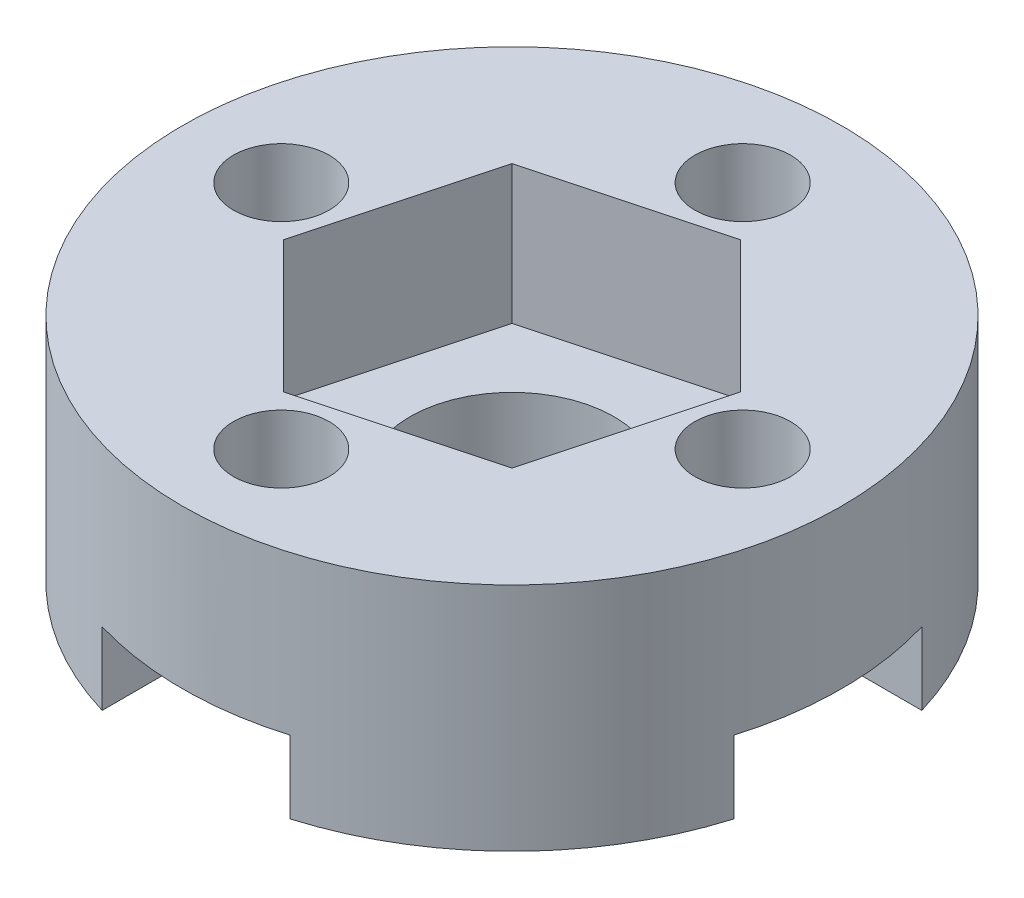
from build123d import *
from build123d.topology import SkipClean

# Parameters (mm, degrees)
SKETCH1_R           = 10
SKETCH1_R_2         = 3.1
SKETCH1_R_3         = 1.45
BOSS_EXTRUDE1_DEPTH = 7
BOSS_EXTRUDE4_START = 1
SKETCH8_R           = 5.25
SKETCH8_R_2         = 3.1
BOSS_EXTRUDE4_DEPTH = 1
CUT_EXTRUDE1_DEPTH  = 3.2
CUT_EXTRUDE2_DEPTH  = 4.2


with BuildPart() as part:
    # Sketch1 → Boss-Extrude1 (new body)
    with BuildSketch(Plane(origin=(0, 0, 0), x_dir=(1, 0, 0), z_dir=(0, 1, 0))):
        with Locations(Location((0, 0, 0), (0, 0, 270))):
            Circle(SKETCH1_R)
        with Locations(Location((0, 0, 0), (0, 0, 270))):
            Circle(SKETCH1_R_2, mode=Mode.SUBTRACT)
        with Locations(Location((0, 7, 0), (0, 0, 270))):
            Circle(SKETCH1_R_3, mode=Mode.SUBTRACT)
        with Locations(Location((7, 0, 0), (0, 0, 270))):
            Circle(SKETCH1_R_3, mode=Mode.SUBTRACT)
        with Locations(Location((0, -7, 0), (0, 0, 270))):
            Circle(SKETCH1_R_3, mode=Mode.SUBTRACT)
        with Locations(Location((-7, 0, 0), (0, 0, 270))):
            Circle(SKETCH1_R_3, mode=Mode.SUBTRACT)
    extrude(amount=BOSS_EXTRUDE1_DEPTH)

    # Sketch8 → Boss-Extrude4 (add)
    with SkipClean():  # the faces are left unmerged after this step: merging them gives an invalid solid
        with BuildSketch(Plane.XZ.offset(BOSS_EXTRUDE4_START)):
            with Locations(Location((0, 0, 0), (0, 0, 90))):
                Circle(SKETCH8_R)
            with Locations(Location((0, 0, 0), (0, 0, 270))):
                Circle(SKETCH8_R_2, mode=Mode.SUBTRACT)
        extrude(amount=-BOSS_EXTRUDE4_DEPTH)

    # Sketch9 → Cut-Extrude1 (cut)
    with SkipClean():  # the faces are left unmerged after this step: merging them gives an invalid solid
        with BuildSketch(Plane.XZ.offset(1)):
            with BuildLine():
                Line((-7, 2.85), (-9.585275166, 2.85))
                ThreePointArc((-9.585275166, 2.85), (-10, 0), (-9.585275166, -2.85))
                Line((-9.585275166, -2.85), (-7, -2.85))
                ThreePointArc((-7, -2.85), (-5.845254282, -2.605582915), (-4.888571429, -1.914254264))
                ThreePointArc((-4.888571429, -1.914254264), (-5.25, 0), (-4.888571429, 1.914254264))
                ThreePointArc((-4.888571429, 1.914254264), (-5.845254282, 2.605582915), (-7, 2.85))
            make_face()
            with BuildLine():
                Line((-2.85, 9.585275166), (-2.85, 7))
                ThreePointArc((-2.85, 7), (-2.605582915, 5.845254282), (-1.914254264, 4.888571429))
                ThreePointArc((-1.914254264, 4.888571429), (0, 5.25), (1.914254264, 4.888571429))
                ThreePointArc((1.914254264, 4.888571429), (2.605582915, 5.845254282), (2.85, 7))
                Line((2.85, 7), (2.85, 9.585275166))
                ThreePointArc((2.85, 9.585275166), (0, 10), (-2.85, 9.585275166))
            make_face()
            with BuildLine():
                ThreePointArc((10, 0), (9.895775656, 1.440008393), (9.585275166, 2.85))
                Line((9.585275166, 2.85), (7, 2.85))
                ThreePointArc((7, 2.85), (5.845254282, 2.605582915), (4.888571429, 1.914254264))
                ThreePointArc((4.888571429, 1.914254264), (5.158851616, 0.974037987), (5.25, 0))
                ThreePointArc((5.25, 0), (5.158851616, -0.974037987), (4.888571429, -1.914254264))
                ThreePointArc((4.888571429, -1.914254264), (5.845254282, -2.605582915), (7, -2.85))
                Line((7, -2.85), (9.585275166, -2.85))
                ThreePointArc((9.585275166, -2.85), (9.895775656, -1.440008393), (10, 0))
            make_face()
            with BuildLine():
                Line((-2.85, -7), (-2.85, -9.585275166))
                ThreePointArc((-2.85, -9.585275166), (0, -10), (2.85, -9.585275166))
                Line((2.85, -9.585275166), (2.85, -7))
                ThreePointArc((2.85, -7), (2.605582915, -5.845254282), (1.914254264, -4.888571429))
                ThreePointArc((1.914254264, -4.888571429), (0, -5.25), (-1.914254264, -4.888571429))
                ThreePointArc((-1.914254264, -4.888571429), (-2.605582915, -5.845254282), (-2.85, -7))
            make_face()
            with BuildLine():
                ThreePointArc((-4.888571429, -1.914254264), (-4.15, 0), (-4.888571429, 1.914254264))
                ThreePointArc((-4.888571429, 1.914254264), (-5.25, 0), (-4.888571429, -1.914254264))
            make_face()
            with BuildLine():
                ThreePointArc((1.914254264, 4.888571429), (0, 5.25), (-1.914254264, 4.888571429))
                ThreePointArc((-1.914254264, 4.888571429), (0, 4.15), (1.914254264, 4.888571429))
            make_face()
            with BuildLine():
                ThreePointArc((5.25, 0), (5.158851616, 0.974037987), (4.888571429, 1.914254264))
                ThreePointArc((4.888571429, 1.914254264), (4.15, 0), (4.888571429, -1.914254264))
                ThreePointArc((4.888571429, -1.914254264), (5.158851616, -0.974037987), (5.25, 0))
            make_face()
            with BuildLine():
                ThreePointArc((1.914254264, -4.888571429), (0, -4.15), (-1.914254264, -4.888571429))
                ThreePointArc((-1.914254264, -4.888571429), (0, -5.25), (1.914254264, -4.888571429))
            make_face()
        extrude(amount=-CUT_EXTRUDE1_DEPTH, mode=Mode.SUBTRACT)

    # Sketch10 → Cut-Extrude2 (cut)
    with BuildSketch(Plane(origin=(0, 7, 0), x_dir=(1, 0, 0), z_dir=(0, 1, 0))):
        Polygon((1.464406605, 5.465239851), (-4.000833247, 4.000833247), (-5.465239851, -1.464406605), (-1.464406605, -5.465239851), (4.000833247, -4.000833247), (5.465239851, 1.464406605), align=None)
    extrude(amount=-CUT_EXTRUDE2_DEPTH, mode=Mode.SUBTRACT)


solid = part.part
